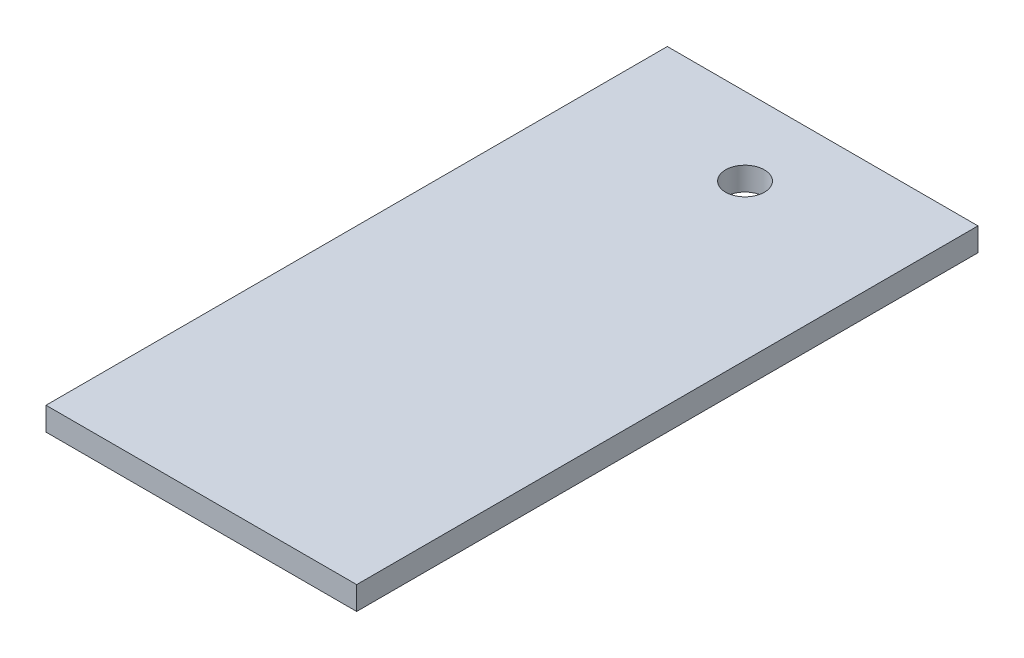
from build123d import *

# Parameters (mm, degrees)
SKETCH1_W           = 40
SKETCH1_H           = 80
BOSS_EXTRUDE1_DEPTH = 3
SKETCH2_R           = 2.5
CUT_EXTRUDE1_DEPTH  = 14


with BuildPart() as part:
    # Sketch1 → Boss-Extrude1 (new body)
    with BuildSketch(Plane(origin=(0, 0, 0), x_dir=(1, 0, 0), z_dir=(0, 1, 0))):
        Rectangle(SKETCH1_W, SKETCH1_H)
    extrude(amount=BOSS_EXTRUDE1_DEPTH)

    # Sketch2 → Cut-Extrude1 (cut)
    with BuildSketch(Plane(origin=(0, 3, 0), x_dir=(1, 0, 0), z_dir=(0, 1, 0))):
        with Locations(Location((0, 30, 0), (0, 0, 270))):
            Circle(SKETCH2_R)
    extrude(amount=-CUT_EXTRUDE1_DEPTH, mode=Mode.SUBTRACT)


solid = part.part
